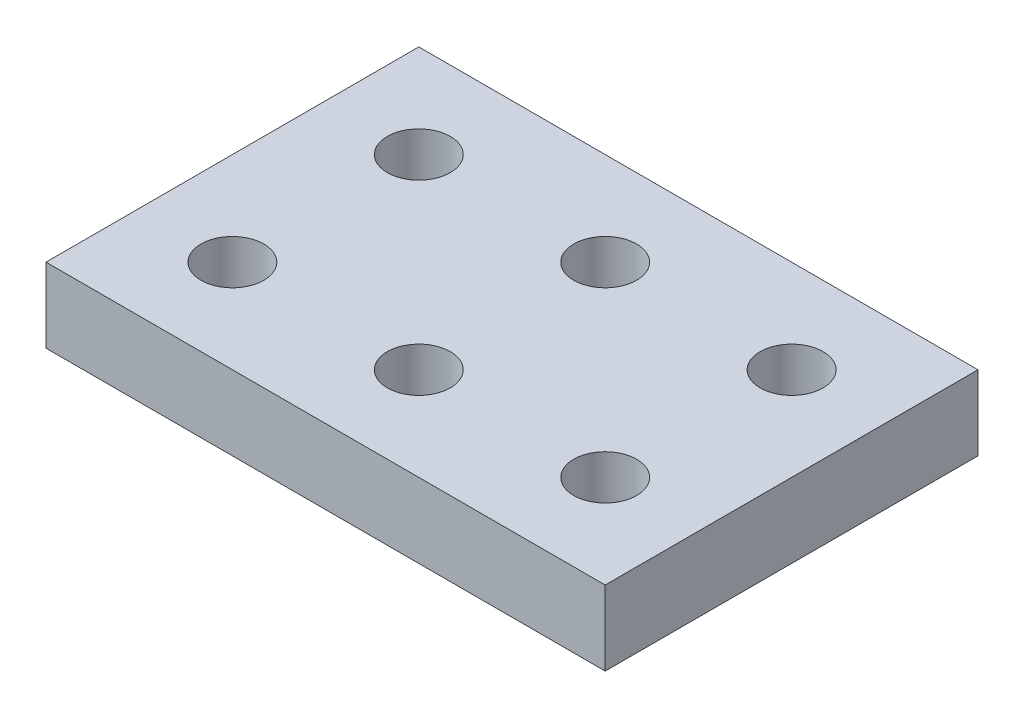
from build123d import *

# Parameters (mm, degrees)
SKETCH_1_W                       = 240
SKETCH_1_H                       = 160
EXTRUDE_1_DEPTH                  = 32
SKETCH_3_R                       = 13.5
CUT_EXTRUDE_2_DEPTH              = 291.213714355
PATTERN_LINEAR_5_COUNT           = 2
PATTERN_LINEAR_5_PITCH           = 80
PATTERN_LINEAR_6_COUNT           = 2
PATTERN_LINEAR_6_PITCH           = 80
PATTERN_LINEAR_7_COUNT           = 2
PATTERN_LINEAR_7_PITCH           = 80
PATTERN_LINEAR_7_COPY_1_SKETCH_R = 13.5
PATTERN_LINEAR_7_COPY_1_DEPTH    = 291.213714355
PATTERN_LINEAR_7_COPY_2_SKETCH_R = 13.5
PATTERN_LINEAR_7_COPY_2_DEPTH    = 291.213714355


with BuildPart() as part:
    # 草图1 → 凸台-拉伸1 (new body)
    with BuildSketch(Plane(origin=(0, 0, 0), x_dir=(1, 0, 0), z_dir=(0, 1, 0))):
        with Locations((120, 80)):
            Rectangle(SKETCH_1_W, SKETCH_1_H)
    extrude(amount=EXTRUDE_1_DEPTH)

    # 草图3 → 切除-拉伸2 (cut, through all)
    with BuildSketch(Plane(origin=(0, 32, 0), x_dir=(1, 0, 0), z_dir=(0, 1, 0))):
        with Locations(Location((120, 120, 0), (0, 0, 270))):
            Circle(SKETCH_3_R)
    cut_extrude_2 = extrude(amount=-CUT_EXTRUDE_2_DEPTH, mode=Mode.SUBTRACT)

    # 阵列(线性)5: 切除-拉伸2 ×2
    with Locations(*[(-i * PATTERN_LINEAR_5_PITCH, 0, 0) for i in range(1, PATTERN_LINEAR_5_COUNT)]):
        add(cut_extrude_2, mode=Mode.SUBTRACT)

    # 阵列(线性)6: 切除-拉伸2 ×2
    with Locations(*[(i * PATTERN_LINEAR_6_PITCH, 0, 0) for i in range(1, PATTERN_LINEAR_6_COUNT)]):
        add(cut_extrude_2, mode=Mode.SUBTRACT)

    # 阵列(线性)7: 切除-拉伸2 ×2
    with Locations(*[(0, 0, i * PATTERN_LINEAR_7_PITCH) for i in range(1, PATTERN_LINEAR_7_COUNT)]):
        add(cut_extrude_2, mode=Mode.SUBTRACT)

    # 阵列(线性)7 copy 1 sketch → 阵列(线性)7 copy 1 (cut, through all)
    with BuildSketch(Plane(origin=(-80, 32, 80), x_dir=(1, 0, 0), z_dir=(0, 1, 0))):
        with Locations(Location((120, 120, 0), (0, 0, 270))):
            Circle(PATTERN_LINEAR_7_COPY_1_SKETCH_R)
    extrude(amount=-PATTERN_LINEAR_7_COPY_1_DEPTH, mode=Mode.SUBTRACT)

    # 阵列(线性)7 copy 2 sketch → 阵列(线性)7 copy 2 (cut, through all)
    with BuildSketch(Plane(origin=(80, 32, 80), x_dir=(1, 0, 0), z_dir=(0, 1, 0))):
        with Locations(Location((120, 120, 0), (0, 0, 270))):
            Circle(PATTERN_LINEAR_7_COPY_2_SKETCH_R)
    extrude(amount=-PATTERN_LINEAR_7_COPY_2_DEPTH, mode=Mode.SUBTRACT)


solid = part.part
